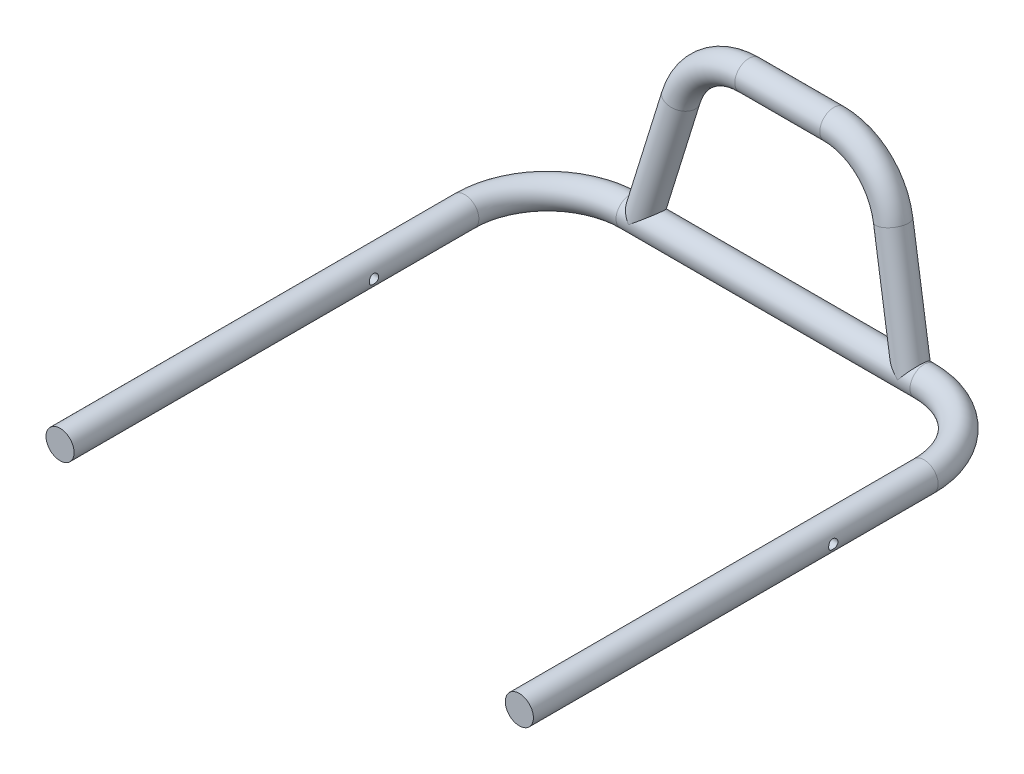
from build123d import *

# Parameters (mm, degrees)
SWEEP1_PROFILE_R   = 9.525
SWEEP2_PROFILE_R   = 9.525
SKETCH37_R         = 3.175
CUT_EXTRUDE1_DEPTH = 405.640507596


with BuildPart() as part:
    # Sweep1: sweep along a path in Sketch2
    with BuildLine(Plane(origin=(0, -28.669314133, -327.691760022), x_dir=(-1, 0, 0), z_dir=(0, 0.08715574274765835, 0.9961946980917455))) as sweep1_path:
        Line((0, -139.683627769), (28.771853902, -139.683627769))
        ThreePointArc((28.771853902, -139.683627769), (56.13800648, -130.260705766), (71.901498935, -105.987056028))
        Line((71.901498935, -105.987056028), (91.151672667, -28.778826255))
    # Sweep1 profile (on start of the path) → Sweep1 (sweep)
    with BuildSketch(Plane(origin=(0, 110.482775261, -339.86599035), x_dir=(0, 0, -1), z_dir=(-1, 0, 0))):
        Circle(SWEEP1_PROFILE_R)
    sweep1 = sweep(path=sweep1_path.line)

    # Sweep2: sweep along a path in Sketch1
    with BuildLine(Plane(origin=(0, 0, 0), x_dir=(1, 0, 0), z_dir=(0, 1, 0))) as sweep2_path:
        Line((0, 330.2), (-99.575, 330.2))
        ThreePointArc((-99.575, 330.2), (-139.172979746, 313.797979746), (-155.575, 274.2))
        Line((-155.575, 274.2), (-155.575, 0))
    # Sweep2 profile (on start of the path) → Sweep2 (sweep)
    with BuildSketch(Plane(origin=(0, 0, -330.2), x_dir=(0, 0, -1), z_dir=(-1, 0, 0))):
        Circle(SWEEP2_PROFILE_R)
    sweep2 = sweep(path=sweep2_path.line)

    # Sketch37 → Cut-Extrude1 (cut, through all)
    with BuildSketch(Plane(origin=(0, 0, 0), x_dir=(0, 0, -1), z_dir=(1, 0, 0))):
        with Locations((203.2, 0)):
            Circle(SKETCH37_R)
    cut_extrude1 = extrude(amount=-CUT_EXTRUDE1_DEPTH, mode=Mode.SUBTRACT)

    # Mirror1: Sweep1, Sweep2, Cut-Extrude1 across plane
    add(sweep1.mirror(Plane(origin=(0, 0, 0), x_dir=(0, 0, 1), z_dir=(1, 0, 0))))
    add(sweep2.mirror(Plane(origin=(0, 0, 0), x_dir=(0, 0, 1), z_dir=(1, 0, 0))))
    add(cut_extrude1.mirror(Plane(origin=(0, 0, 0), x_dir=(0, 0, 1), z_dir=(1, 0, 0))), mode=Mode.SUBTRACT)


solid = part.part
